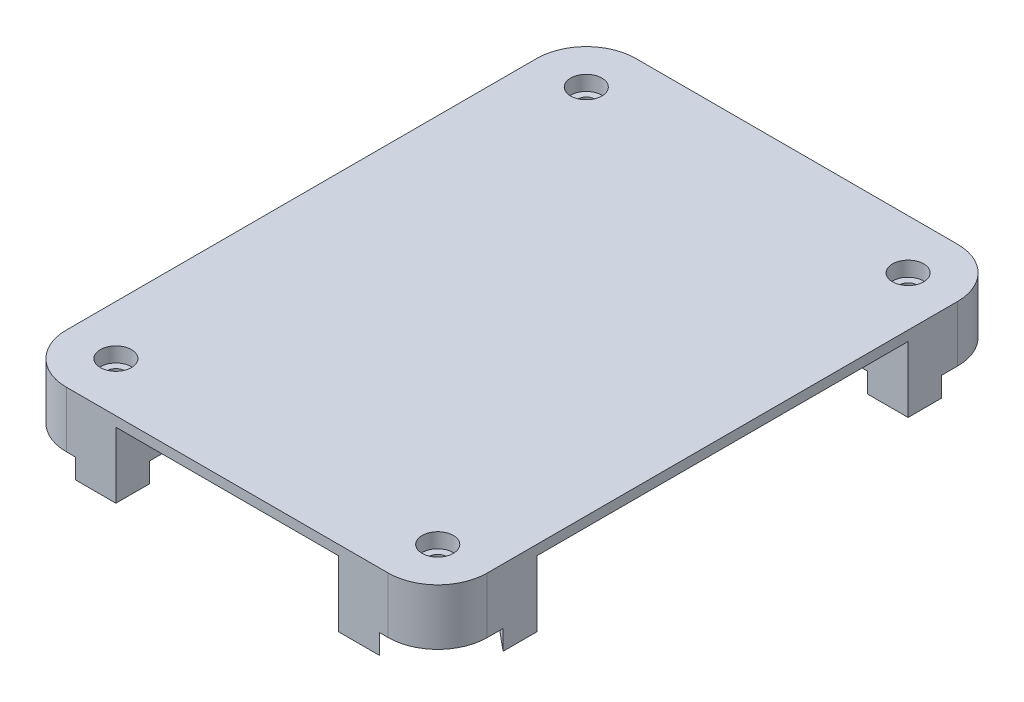
from build123d import *

# Parameters (mm, degrees)
SKETCH1_W               = 107.95
SKETCH1_H               = 146.05
BOSS_EXTRUDE1_DEPTH     = 2.54
SKETCH13_W              = 25.4
SKETCH13_H              = 25.4
BOSS_EXTRUDE4_DEPTH     = 19.431
SKETCH2_R               = 3.302
CUT_EXTRUDE1_DEPTH      = 93.862882849
FILLET1_R               = 12.7
CUT_EXTRUDE13_DEPTH     = 5.08
SKETCH15_R              = 6.35
BOSS_EXTRUDE5_DEPTH     = 11.811
SKETCH23_R              = 2.25
CUT_EXTRUDE14_DEPTH     = 92.934228941
SKETCH24_R              = 4
CUT_EXTRUDE15_DEPTH     = 3.81
MIRROR2_COPY_1_SKETCH_R = 2.25
MIRROR2_COPY_1_DEPTH    = 92.934228941
MIRROR2_COPY_2_SKETCH_R = 4
MIRROR2_COPY_2_DEPTH    = 3.81
FILLET3_R               = 12.7
FILLET4_R               = 1.016


with BuildPart() as part:
    # Sketch1 → Boss-Extrude1 (new body)
    with BuildSketch(Plane(origin=(0, 0, 0), x_dir=(1, 0, 0), z_dir=(0, 1, 0))):
        Rectangle(SKETCH1_W, SKETCH1_H)
    extrude(amount=-BOSS_EXTRUDE1_DEPTH)

    # Sketch13 → Boss-Extrude4 (add)
    with BuildSketch(Plane(origin=(0, 0, 0), x_dir=(1, 0, 0), z_dir=(0, 1, 0))):
        with Locations((41.275, -60.325)):
            Rectangle(SKETCH13_W, SKETCH13_H)
        with Locations((-41.275, -60.325)):
            Rectangle(SKETCH13_W, SKETCH13_H)
        with Locations((-41.275, 60.325)):
            Rectangle(SKETCH13_W, SKETCH13_H)
        with Locations((41.275, 60.325)):
            Rectangle(SKETCH13_W, SKETCH13_H)
    extrude(amount=-BOSS_EXTRUDE4_DEPTH)

    # Sketch2 → Cut-Extrude1 (cut, through all)
    with BuildSketch(Plane(origin=(0, 0, 0), x_dir=(1, 0, 0), z_dir=(0, 1, 0))):
        with Locations(Location((-41.275, 60.325, 0), (0, 0, 270))):
            Circle(SKETCH2_R)
        with Locations(Location((41.275, 60.325, 0), (0, 0, 90))):
            Circle(SKETCH2_R)
        with Locations(Location((41.275, -60.325, 0), (0, 0, 270))):
            Circle(SKETCH2_R)
        with Locations(Location((-41.275, -60.325, 0), (0, 0, 90))):
            Circle(SKETCH2_R)
    extrude(amount=-CUT_EXTRUDE1_DEPTH, mode=Mode.SUBTRACT)

    # Fillet1
    fillet1_edges = [part.edges().sort_by_distance(p)[0] for p in [
        (53.975, -9.7155, 73.025),
        (-53.975, -9.7155, 73.025),
        (-53.975, -9.7155, -73.025),
        (53.975, -9.7155, -73.025),
    ]]
    fillet(fillet1_edges, radius=FILLET1_R)

    # Sketch14 → Cut-Extrude13 (cut)
    with BuildSketch(Plane.XZ.offset(19.431)):
        Polygon((20.692003582, -28.674172721), (6.35, -45.983487389), (139.336989519, -156.172707277), (153.678993101, -138.863392609), align=None)
        Polygon((-20.692003582, -28.674172721), (-6.35, -45.983487389), (-139.336989519, -156.172707277), (-153.678993101, -138.863392609), align=None)
        Polygon((-153.678993101, 138.863392609), (-20.692003582, 28.674172721), (-6.35, 45.983487389), (-139.336989519, 156.172707277), align=None)
        Polygon((20.692003582, 28.674172721), (6.35, 45.983487389), (139.336989519, 156.172707277), (153.678993101, 138.863392609), align=None)
    extrude(amount=-CUT_EXTRUDE13_DEPTH, mode=Mode.SUBTRACT)

    # Sketch15 → Boss-Extrude5 (add)
    with BuildSketch(Plane(origin=(0, 0, 0), x_dir=(1, 0, 0), z_dir=(0, 1, 0))):
        with Locations((-41.275, 60.325)):
            Circle(SKETCH15_R)
        with Locations((41.275, 60.325)):
            Circle(SKETCH15_R)
        with Locations((-41.275, -60.325)):
            Circle(SKETCH15_R)
        with Locations((41.275, -60.325)):
            Circle(SKETCH15_R)
    extrude(amount=-BOSS_EXTRUDE5_DEPTH)

    # Sketch23 → Cut-Extrude14 (cut, through all)
    with BuildSketch(Plane.XZ.offset(14.351)):
        with Locations(Location((-41.275, -60.325, 0), (0, 0, 270))):
            Circle(SKETCH23_R)
    cut_extrude14 = extrude(amount=-CUT_EXTRUDE14_DEPTH, mode=Mode.SUBTRACT)

    # Sketch24 → Cut-Extrude15 (cut)
    with BuildSketch(Plane(origin=(0, 0, 0), x_dir=(1, 0, 0), z_dir=(0, 1, 0))):
        with Locations(Location((-41.275, 60.325, 0), (0, 0, 270))):
            Circle(SKETCH24_R)
    cut_extrude15 = extrude(amount=-CUT_EXTRUDE15_DEPTH, mode=Mode.SUBTRACT)

    # Mirror1: Cut-Extrude14, Cut-Extrude15 across plane
    add(cut_extrude14.mirror(Plane.XY), mode=Mode.SUBTRACT)
    add(cut_extrude15.mirror(Plane.XY), mode=Mode.SUBTRACT)

    # Mirror2: Cut-Extrude14, Cut-Extrude15 across plane
    add(cut_extrude14.mirror(Plane(origin=(0, 0, 0), x_dir=(0, 0, 1), z_dir=(1, 0, 0))), mode=Mode.SUBTRACT)
    add(cut_extrude15.mirror(Plane(origin=(0, 0, 0), x_dir=(0, 0, 1), z_dir=(1, 0, 0))), mode=Mode.SUBTRACT)

    # Mirror2 copy 1 sketch → Mirror2 copy 1 (cut, through all)
    with BuildSketch(Plane(origin=(0, -14.351, 0), x_dir=(-1, 0, 0), z_dir=(0, -1, 0))):
        with Locations(Location((-41.275, -60.325, 0), (0, 0, 270))):
            Circle(MIRROR2_COPY_1_SKETCH_R)
    extrude(amount=-MIRROR2_COPY_1_DEPTH, mode=Mode.SUBTRACT)

    # Mirror2 copy 2 sketch → Mirror2 copy 2 (cut)
    with BuildSketch(Plane(origin=(0, 0, 0), x_dir=(-1, 0, 0), z_dir=(0, 1, 0))):
        with Locations(Location((-41.275, 60.325, 0), (0, 0, 270))):
            Circle(MIRROR2_COPY_2_SKETCH_R)
    extrude(amount=-MIRROR2_COPY_2_DEPTH, mode=Mode.SUBTRACT)

    # Fillet3
    fillet3_edges = [part.edges().sort_by_distance(p)[0] for p in [
        (28.575, -8.4455, -47.625),
        (-28.575, -8.4455, -47.625),
        (-28.575, -8.4455, 47.625),
        (28.575, -8.4455, 47.625),
    ]]
    fillet(fillet3_edges, radius=FILLET3_R)

    # Fillet4
    fillet4_edges = [part.edges().sort_by_distance(p)[0] for p in [
        (41.275, -14.351, -57.023),
        (-41.275, -14.351, -63.627),
        (-41.275, -14.351, 63.627),
        (41.275, -14.351, 57.023),
    ]]
    fillet(fillet4_edges, radius=FILLET4_R)


solid = part.part
